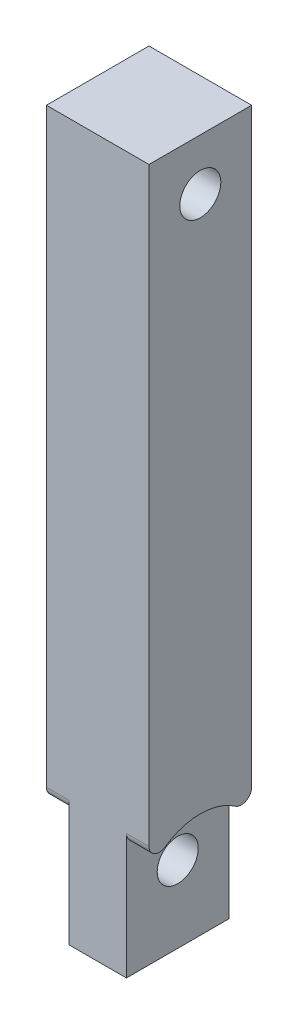
from build123d import *

# Parameters (mm, degrees)
SKETCH1_W               = 50
SKETCH1_H               = 50
BOSS_EXTRUDE1_DEPTH     = 300
SKETCH2_W               = 28
SKETCH2_H               = 50
BOSS_EXTRUDE2_DEPTH     = 48.9
CUT_EXTRUDE4_DEPTH      = 309.220700148
CUT_EXTRUDE4_DEPTH_BACK = 11
CUT_EXTRUDE7_DEPTH      = 11
SKETCH12_R              = 10
CUT_EXTRUDE8_DEPTH      = 307.628439646
FILLET2_R               = 5
FILLET3_R               = 5
SKETCH13_R              = 10
CUT_EXTRUDE9_DEPTH      = 309.220700148


with BuildPart() as part:
    # Sketch1 → Boss-Extrude1 (new body)
    with BuildSketch(Plane(origin=(0, 0, 0), x_dir=(1, 0, 0), z_dir=(0, 1, 0))):
        with Locations((-25, 25)):
            Rectangle(SKETCH1_W, SKETCH1_H)
    extrude(amount=BOSS_EXTRUDE1_DEPTH)

    # Sketch2 → Boss-Extrude2 (add)
    with BuildSketch(Plane.XZ):
        with Locations((-25, -25)):
            Rectangle(SKETCH2_W, SKETCH2_H)
    extrude(amount=BOSS_EXTRUDE2_DEPTH)

    # Sketch5 → Cut-Extrude4 (cut, two sides: drawn at the far end of the back side and taken through both)
    with BuildSketch(Plane(origin=(0, 0, 0), x_dir=(0, 0, -1), z_dir=(1, 0, 0)).offset(-CUT_EXTRUDE4_DEPTH_BACK)):
        with BuildLine():
            Line((50, 0), (0, 0))
            ThreePointArc((0, 0), (25, 13.416876048), (50, 0))
        make_face()
    extrude(amount=CUT_EXTRUDE4_DEPTH + CUT_EXTRUDE4_DEPTH_BACK, mode=Mode.SUBTRACT)

    # Sketch6 → Cut-Extrude7 (cut)
    with BuildSketch(Plane.ZY.offset(50)):
        with BuildLine():
            Line((-50, 0), (0, 0))
            ThreePointArc((0, 0), (-25, 13.416876048), (-50, 0))
        make_face()
    extrude(amount=-CUT_EXTRUDE7_DEPTH, mode=Mode.SUBTRACT)

    # Sketch12 → Cut-Extrude8 (cut, through all)
    with BuildSketch(Plane.ZY.offset(39)):
        with Locations((-25, -11.583123952)):
            Circle(SKETCH12_R)
    extrude(amount=-CUT_EXTRUDE8_DEPTH, mode=Mode.SUBTRACT)

    # Fillet2
    fillet2_edges = [part.edges().sort_by_distance(p)[0] for p in [
        (-44.5, 0, -50),
        (-44.5, 0, 0),
    ]]
    fillet(fillet2_edges, radius=FILLET2_R)

    # Fillet3
    fillet3_edges = [part.edges().sort_by_distance(p)[0] for p in [
        (-5.5, 0, 0),
        (-5.5, 0, -50),
    ]]
    fillet(fillet3_edges, radius=FILLET3_R)

    # Sketch13 → Cut-Extrude9 (cut, through all)
    with BuildSketch(Plane(origin=(0, 0, 0), x_dir=(0, 0, -1), z_dir=(1, 0, 0))):
        with Locations((25, 275)):
            Circle(SKETCH13_R)
    extrude(amount=-CUT_EXTRUDE9_DEPTH, mode=Mode.SUBTRACT)


solid = part.part
